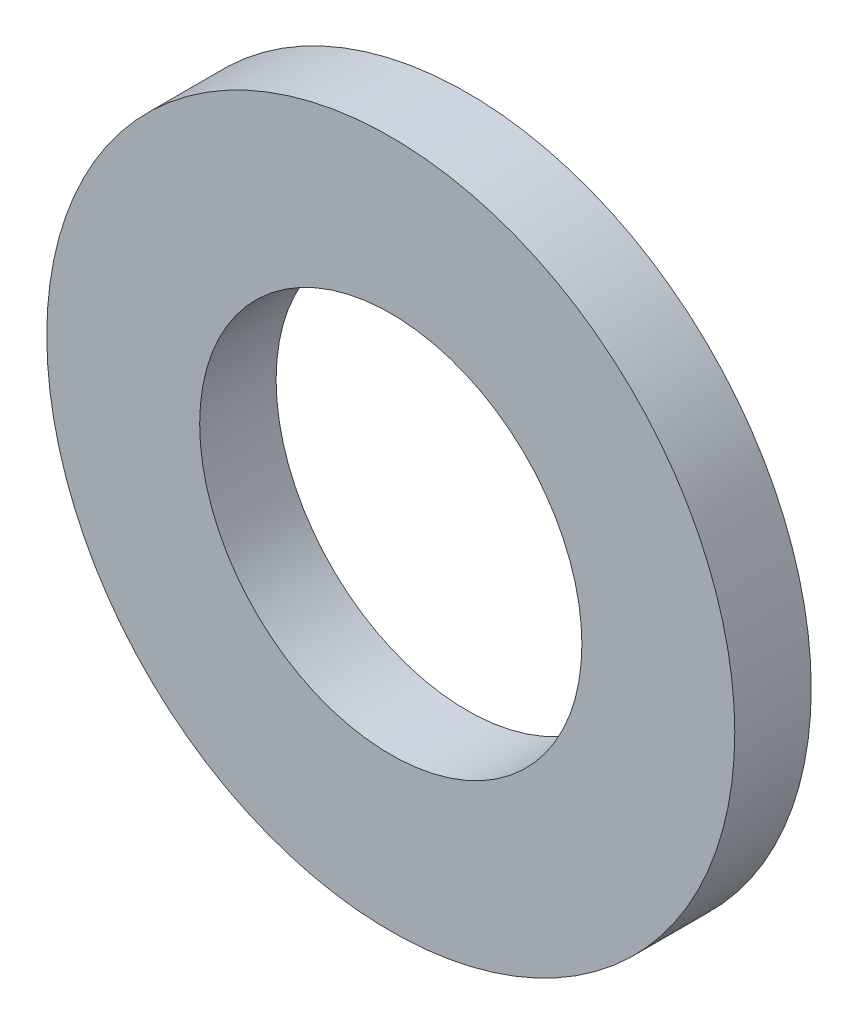
from build123d import *

# Parameters (mm, degrees)
SKETCH_1_R      = 4.5
SKETCH_1_R_2    = 2.5
EXTRUDE_1_DEPTH = 1


with BuildPart() as part:
    # 草图1 → 凸台-拉伸1 (new body)
    with BuildSketch(Plane.XY):
        Circle(SKETCH_1_R)
        Circle(SKETCH_1_R_2, mode=Mode.SUBTRACT)
    extrude(amount=EXTRUDE_1_DEPTH)


solid = part.part
